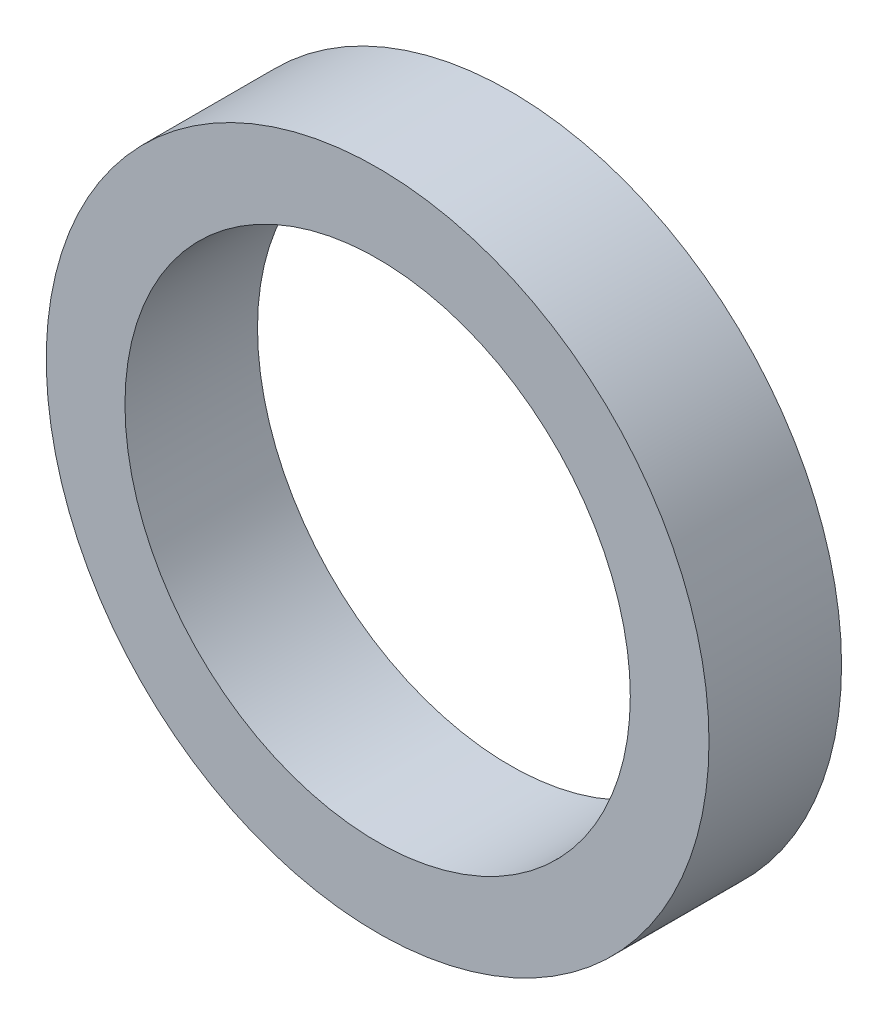
from build123d import *

# Parameters (mm, degrees)
INNER_RACE_SPACER_H0P8_START = 1
SKETCH1_R                    = 2
SKETCH1_R_2                  = 1.525
INNER_RACE_SPACER_H0P8_DEPTH = 0.8


with BuildPart() as part:
    # Sketch1 → Inner_Race_Spacer_H0p8 (new body)
    with BuildSketch(Plane.XY.offset(INNER_RACE_SPACER_H0P8_START)):
        Circle(SKETCH1_R)
        Circle(SKETCH1_R_2, mode=Mode.SUBTRACT)
    extrude(amount=INNER_RACE_SPACER_H0P8_DEPTH)


solid = part.part
